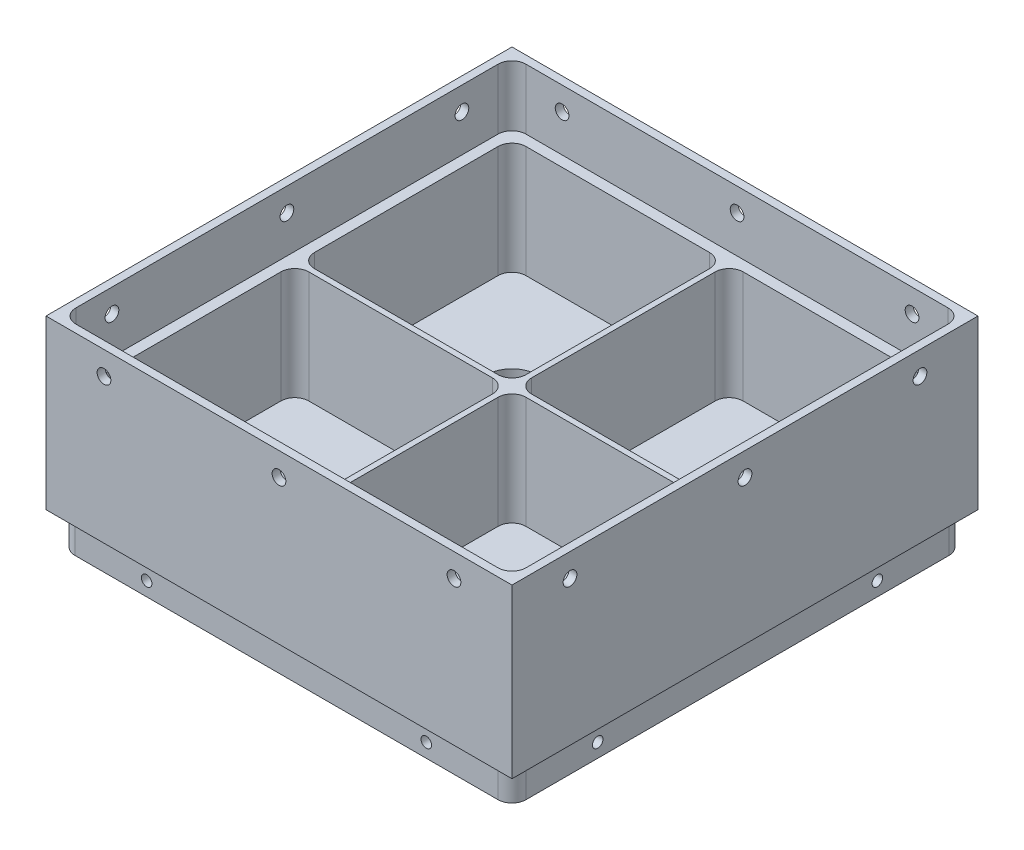
from build123d import *

# Parameters (mm, degrees)
SKETCH1_W                   = 100
SKETCH1_H                   = 100
SKETCH1_W_2                 = 45.4
SKETCH1_H_2                 = 45.4
BOSS_EXTRUDE1_DEPTH         = 24
FILLET1_R                   = 3
SKETCH2_W                   = 100
SKETCH2_H                   = 100
BOSS_EXTRUDE2_DEPTH         = 6
SKETCH3_W                   = 100
SKETCH3_H                   = 100
SKETCH3_W_2                 = 96.8
SKETCH3_H_2                 = 96.8
CUT_EXTRUDE1_DEPTH          = 7
SKETCH4_R                   = 1.1305
CUT_EXTRUDE2_DEPTH          = 4.7
SKETCH5_W                   = 100
SKETCH5_H                   = 100
SKETCH5_W_2                 = 96.6
SKETCH5_H_2                 = 96.6
BOSS_EXTRUDE3_DEPTH         = 13
FILLET2_R                   = 3
SKETCH6_R                   = 5.5
CUT_EXTRUDE3_DEPTH          = 80.806014811
F_32_0_116_DIAMETER_HOLE1_D = 2.9464
F_32_0_116_DIAMETER_HOLE2_D = 2.9464
F_4_40_TAPPED_HOLE1_D       = 2.2606
F_4_40_TAPPED_HOLE1_DEPTH   = 8.86
F_4_40_TAPPED_HOLE1_TIP     = 0.679152758
F_4_40_TAPPED_HOLE2_D       = 2.2606
F_4_40_TAPPED_HOLE2_DEPTH   = 8.87
F_4_40_TAPPED_HOLE2_TIP     = 0.679152758
F_4_40_TAPPED_HOLE3_D       = 2.2606
F_4_40_TAPPED_HOLE3_DEPTH   = 8.87
F_4_40_TAPPED_HOLE3_TIP     = 0.679152758
F_4_40_TAPPED_HOLE4_D       = 2.2606
F_4_40_TAPPED_HOLE4_DEPTH   = 8.87
F_4_40_TAPPED_HOLE4_TIP     = 0.679152758


with BuildPart() as part:
    # Sketch1 → Boss-Extrude1 (new body)
    with BuildSketch(Plane(origin=(0, 0, 0), x_dir=(1, 0, 0), z_dir=(0, 1, 0))):
        Rectangle(SKETCH1_W, SKETCH1_H)
        with Locations((-23.3, -23.3)):
            Rectangle(SKETCH1_W_2, SKETCH1_H_2, mode=Mode.SUBTRACT)
        with Locations((-23.3, 23.3)):
            Rectangle(SKETCH1_W_2, SKETCH1_H_2, mode=Mode.SUBTRACT)
        with Locations((23.3, -23.3)):
            Rectangle(SKETCH1_W_2, SKETCH1_H_2, mode=Mode.SUBTRACT)
        with Locations((23.3, 23.3)):
            Rectangle(SKETCH1_W_2, SKETCH1_H_2, mode=Mode.SUBTRACT)
    extrude(amount=BOSS_EXTRUDE1_DEPTH)

    # Fillet1
    fillet1_edges = [part.edges().sort_by_distance(p)[0] for p in [
        (-46, 12, 46),
        (-0.6, 12, 46),
        (-0.6, 12, 0.6),
        (-46, 12, 0.6),
        (-46, 12, -46),
        (-46, 12, -0.6),
        (-0.6, 12, -0.6),
        (-0.6, 12, -46),
        (46, 12, -0.6),
        (46, 12, -46),
        (0.6, 12, -46),
        (0.6, 12, -0.6),
        (0.6, 12, 46),
        (46, 12, 46),
        (46, 12, 0.6),
        (0.6, 12, 0.6),
    ]]
    fillet(fillet1_edges, radius=FILLET1_R)

    # Sketch2 → Boss-Extrude2 (add)
    with BuildSketch(Plane.XZ):
        Rectangle(SKETCH2_W, SKETCH2_H)
    extrude(amount=BOSS_EXTRUDE2_DEPTH)

    # Sketch3 → Cut-Extrude1 (cut)
    with BuildSketch(Plane.XZ.offset(6)):
        Rectangle(SKETCH3_W, SKETCH3_H)
        Rectangle(SKETCH3_W_2, SKETCH3_H_2, mode=Mode.SUBTRACT)
    extrude(amount=-CUT_EXTRUDE1_DEPTH, mode=Mode.SUBTRACT)

    # Sketch4 → Cut-Extrude2 (cut)
    with BuildSketch(Plane.XZ.offset(6)):
        with Locations(Location((42.865, -40.005, 0), (0, 0, 270))):
            Circle(SKETCH4_R)
        with Locations(Location((-42.865, -37.465, 0), (0, 0, 270))):
            Circle(SKETCH4_R)
        with Locations(Location((42.865, 40.005, 0), (0, 0, 270))):
            Circle(SKETCH4_R)
        with Locations(Location((-42.865, 36.195, 0), (0, 0, 270))):
            Circle(SKETCH4_R)
    extrude(amount=-CUT_EXTRUDE2_DEPTH, mode=Mode.SUBTRACT)

    # Sketch5 → Boss-Extrude3 (add)
    with BuildSketch(Plane(origin=(0, 24, 0), x_dir=(1, 0, 0), z_dir=(0, 1, 0))):
        Rectangle(SKETCH5_W, SKETCH5_H)
        Rectangle(SKETCH5_W_2, SKETCH5_H_2, mode=Mode.SUBTRACT)
    extrude(amount=BOSS_EXTRUDE3_DEPTH)

    # Fillet2
    fillet2_edges = [part.edges().sort_by_distance(p)[0] for p in [
        (-48.4, -2.5, -48.4),
        (-48.4, -2.5, 48.4),
        (48.4, -2.5, 48.4),
        (48.4, -2.5, -48.4),
        (48.3, 30.5, 48.3),
        (48.3, 30.5, -48.3),
        (-48.3, 30.5, -48.3),
        (-48.3, 30.5, 48.3),
    ]]
    fillet(fillet2_edges, radius=FILLET2_R)

    # Sketch6 → Cut-Extrude3 (cut, through all)
    with BuildSketch(Plane(origin=(0, 0, 0), x_dir=(1, 0, 0), z_dir=(0, 1, 0))):
        with Locations(Location((-23.3, 23.3, 0), (0, 0, 270))):
            Circle(SKETCH6_R)
        with Locations(Location((23.3, 23.3, 0), (0, 0, 270))):
            Circle(SKETCH6_R)
        with Locations(Location((23.3, -23.3, 0), (0, 0, 270))):
            Circle(SKETCH6_R)
        with Locations(Location((-23.3, -23.3, 0), (0, 0, 270))):
            Circle(SKETCH6_R)
    extrude(amount=-CUT_EXTRUDE3_DEPTH, mode=Mode.SUBTRACT)

    # #32 (0.116) Diameter Hole1 (through all)
    with Locations(Plane.XY.offset(50)):
        with Locations((0, 32), (-37.55, 32), (37.55, 32)):
            Hole(F_32_0_116_DIAMETER_HOLE1_D / 2)

    # #32 (0.116) Diameter Hole2 (through all)
    with Locations(Plane(origin=(50, 0, 0), x_dir=(0, 0, -1), z_dir=(1, 0, 0))):
        with Locations((0, 32), (-37.55, 32), (37.55, 32)):
            Hole(F_32_0_116_DIAMETER_HOLE2_D / 2)

    # #4-40 Tapped Hole1
    with Locations(Plane(origin=(0, 0, -48.4), x_dir=(-1, 0, 0), z_dir=(0, 0, -1))):
        with Locations((-30, -3), (30, -3)):
            Hole(F_4_40_TAPPED_HOLE1_D / 2, depth=F_4_40_TAPPED_HOLE1_DEPTH)
            with Locations((0, 0, -(F_4_40_TAPPED_HOLE1_DEPTH + F_4_40_TAPPED_HOLE1_TIP / 2))):  # 118° drill point
                Cone(0, F_4_40_TAPPED_HOLE1_D / 2, F_4_40_TAPPED_HOLE1_TIP, mode=Mode.SUBTRACT)

    # #4-40 Tapped Hole2
    with Locations(Plane(origin=(48.4, 0, 0), x_dir=(0, 0, -1), z_dir=(1, 0, 0))):
        with Locations((-30, -3), (30, -3)):
            Hole(F_4_40_TAPPED_HOLE2_D / 2, depth=F_4_40_TAPPED_HOLE2_DEPTH)
            with Locations((0, 0, -(F_4_40_TAPPED_HOLE2_DEPTH + F_4_40_TAPPED_HOLE2_TIP / 2))):  # 118° drill point
                Cone(0, F_4_40_TAPPED_HOLE2_D / 2, F_4_40_TAPPED_HOLE2_TIP, mode=Mode.SUBTRACT)

    # #4-40 Tapped Hole3
    with Locations(Plane.XY.offset(48.4)):
        with Locations((-30, -3), (30, -3)):
            Hole(F_4_40_TAPPED_HOLE3_D / 2, depth=F_4_40_TAPPED_HOLE3_DEPTH)
            with Locations((0, 0, -(F_4_40_TAPPED_HOLE3_DEPTH + F_4_40_TAPPED_HOLE3_TIP / 2))):  # 118° drill point
                Cone(0, F_4_40_TAPPED_HOLE3_D / 2, F_4_40_TAPPED_HOLE3_TIP, mode=Mode.SUBTRACT)

    # #4-40 Tapped Hole4
    with Locations(Plane.ZY.offset(48.4)):
        with Locations((-30, -3), (30, -3)):
            Hole(F_4_40_TAPPED_HOLE4_D / 2, depth=F_4_40_TAPPED_HOLE4_DEPTH)
            with Locations((0, 0, -(F_4_40_TAPPED_HOLE4_DEPTH + F_4_40_TAPPED_HOLE4_TIP / 2))):  # 118° drill point
                Cone(0, F_4_40_TAPPED_HOLE4_D / 2, F_4_40_TAPPED_HOLE4_TIP, mode=Mode.SUBTRACT)


solid = part.part
